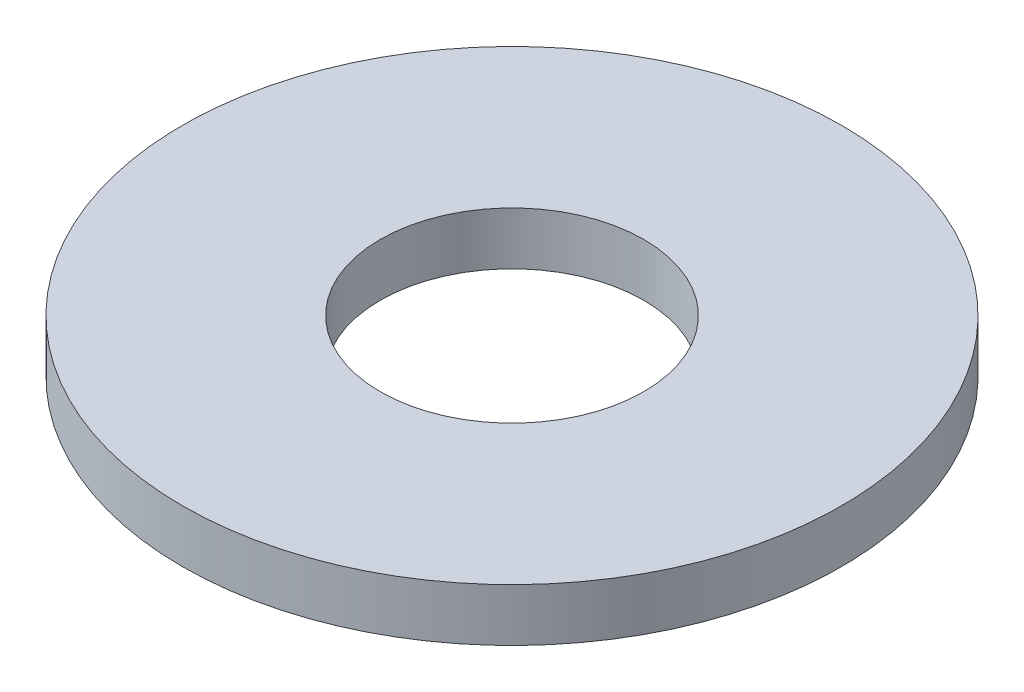
from build123d import *

# Parameters (mm, degrees)
SKETCH1_R           = 5
SKETCH1_R_2         = 2
BOSS_EXTRUDE1_DEPTH = 0.4


with BuildPart() as part:
    # Sketch1 → Boss-Extrude1 (new, symmetric)
    with BuildSketch(Plane(origin=(0, 0, 0), x_dir=(1, 0, 0), z_dir=(0, 1, 0))):
        with Locations(Location((0, 0, 0), (0, 0, 270))):
            Circle(SKETCH1_R)
        with Locations(Location((0, 0, 0), (0, 0, 270))):
            Circle(SKETCH1_R_2, mode=Mode.SUBTRACT)
    extrude(amount=BOSS_EXTRUDE1_DEPTH, both=True)


solid = part.part
